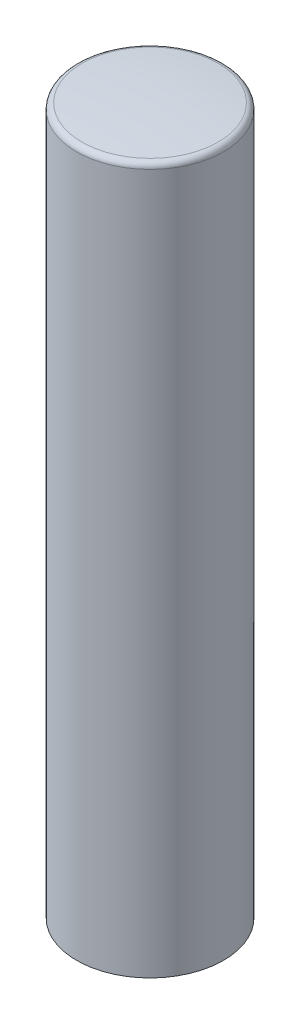
from build123d import *

# Parameters (mm, degrees)
FILLET1_R = 0.2


with BuildPart() as part:
    # Sketch2 → Revolve1 (revolve)
    with BuildSketch(Plane(origin=(0, 0, 0), x_dir=(0, 0, -1), z_dir=(1, 0, 0)), mode=Mode.PRIVATE) as revolve1_sk:
        with BuildLine():
            Line((0, 0), (-2.5, 0))
            Line((-2.5, 0), (-2.5, 24))
            ThreePointArc((-2.5, 24), (-1.251685149, 24.0973709), (0, 24.129857024))
            Line((0, 24.129857024), (0, 0))
        make_face()
    revolve(revolve1_sk.sketch.rotate(Axis((0, 0, 0), (0, 1, 0)), 180), axis=Axis((0, 0, 0), (0, 1, 0)))

    # Fillet1
    fillet1_edges = [part.edges().sort_by_distance(p)[0] for p in [
        (0, 24, 2.5),
    ]]
    fillet(fillet1_edges, radius=FILLET1_R)


solid = part.part
